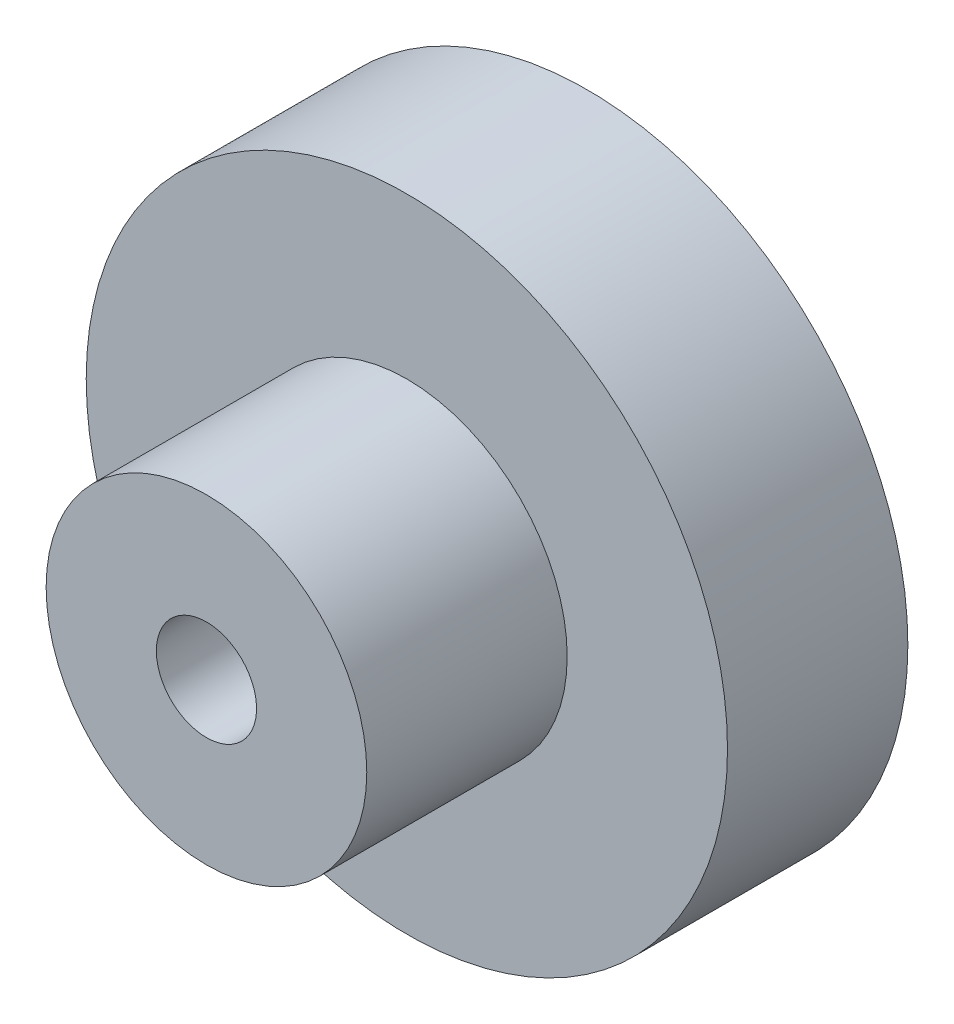
from build123d import *


with BuildPart() as part:
    # Sketch1 → Revolve1 (revolve)
    with BuildSketch(Plane(origin=(0, 0, 0), x_dir=(0, 0, -1), z_dir=(1, 0, 0)), mode=Mode.PRIVATE) as revolve1_sk:
        Polygon((-7.520547945, 4), (-2.520547945, 4), (-2.520547945, 8), (1.979452055, 8), (1.979452055, 1.25), (-7.520547945, 1.25), align=None)
    revolve(revolve1_sk.sketch.rotate(Axis((0, 0, 0), (0, 0, 1)), 90), axis=Axis((0, 0, 0), (0, 0, 1)))


solid = part.part
